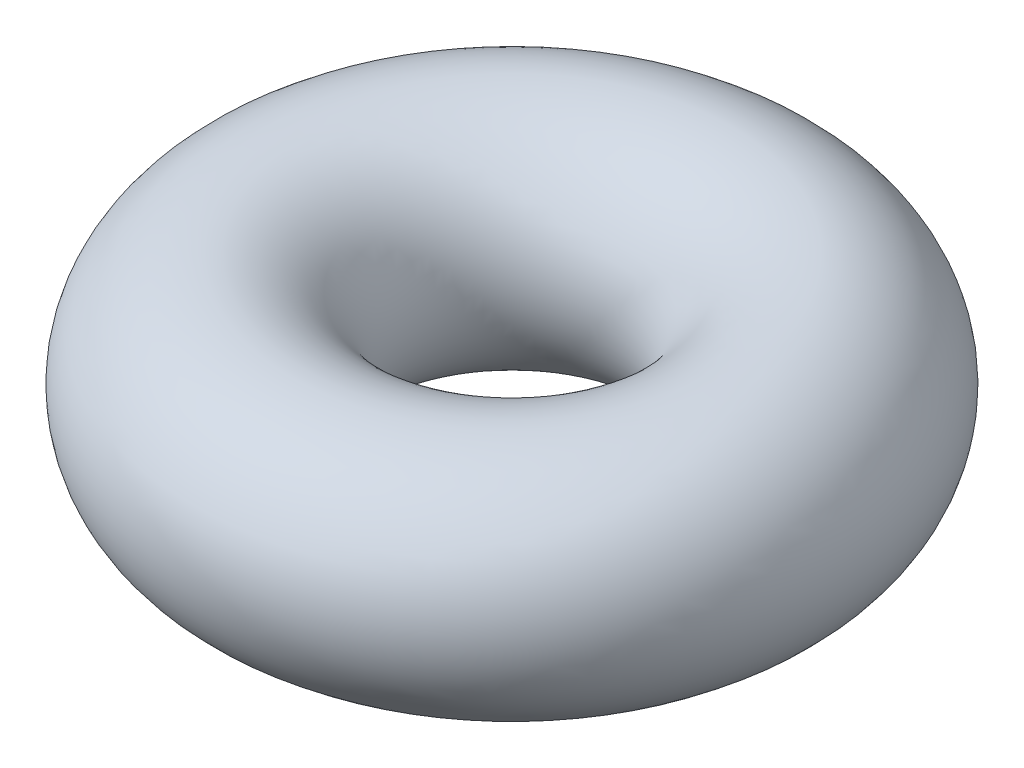
from build123d import *

# Parameters (mm, degrees)
SKETCH3_R   = 31.859481341
SKETCH3_R_2 = 21.859481341


with BuildPart() as part:
    # Sketch3 → Revolve-Thin1 (revolve)
    with BuildSketch(Plane(origin=(0, 0, 0), x_dir=(0, 0, -1), z_dir=(1, 0, 0))):
        with Locations((59.838658235, 0)):
            Circle(SKETCH3_R)
        with Locations((59.838658235, 0)):
            Circle(SKETCH3_R_2, mode=Mode.SUBTRACT)
    revolve(axis=Axis((0, 0, 0), (0, 1, 0)))


solid = part.part
